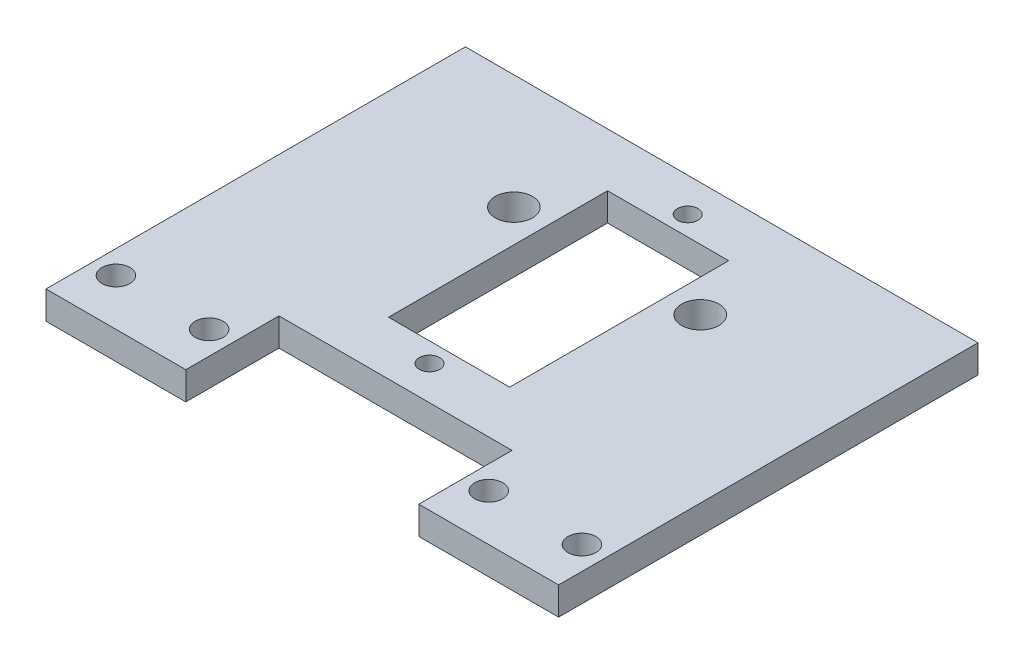
from build123d import *

# Parameters (mm, degrees)
SKETCH1_R           = 1.5
SKETCH1_R_2         = 1.1
SKETCH1_W           = 13
SKETCH1_H           = 23.5
BOSS_EXTRUDE1_DEPTH = 3
SKETCH2_R           = 2
CUT_EXTRUDE1_DEPTH  = 72.126647608


with BuildPart() as part:
    # Sketch1 → Boss-Extrude1 (new body)
    with BuildSketch(Plane(origin=(0, 0, 0), x_dir=(1, 0, 0), z_dir=(0, 1, 0))):
        Polygon((0, 0), (15, 0), (15, 10), (40, 10), (40, 0), (55, 0), (55, 45), (0, 45), align=None)
        with Locations(Location((42.5, 5, 0), (0, 0, 270))):
            Circle(SKETCH1_R, mode=Mode.SUBTRACT)
        with Locations(Location((52.5, 5, 0), (0, 0, 270))):
            Circle(SKETCH1_R, mode=Mode.SUBTRACT)
        with Locations(Location((12.5, 5, 0), (0, 0, 270))):
            Circle(SKETCH1_R, mode=Mode.SUBTRACT)
        with Locations(Location((2.5, 5, 0), (0, 0, 270))):
            Circle(SKETCH1_R, mode=Mode.SUBTRACT)
        with Locations(Location((27.5, 41.35, 0), (0, 0, 270))):
            Circle(SKETCH1_R_2, mode=Mode.SUBTRACT)
        with Locations(Location((27.5, 13.65, 0), (0, 0, 90))):
            Circle(SKETCH1_R_2, mode=Mode.SUBTRACT)
        with Locations((27.5, 27.5)):
            Rectangle(SKETCH1_W, SKETCH1_H, mode=Mode.SUBTRACT)
    extrude(amount=BOSS_EXTRUDE1_DEPTH)

    # Sketch2 → Cut-Extrude1 (cut, through all)
    with BuildSketch(Plane(origin=(0, 3, 0), x_dir=(1, 0, 0), z_dir=(0, 1, 0))):
        with Locations(Location((17.5, 32.699969783, 0), (0, 0, 270))):
            Circle(SKETCH2_R)
        with Locations(Location((37.5, 32.699969783, 0), (0, 0, 90))):
            Circle(SKETCH2_R)
    extrude(amount=-CUT_EXTRUDE1_DEPTH, mode=Mode.SUBTRACT)


solid = part.part
